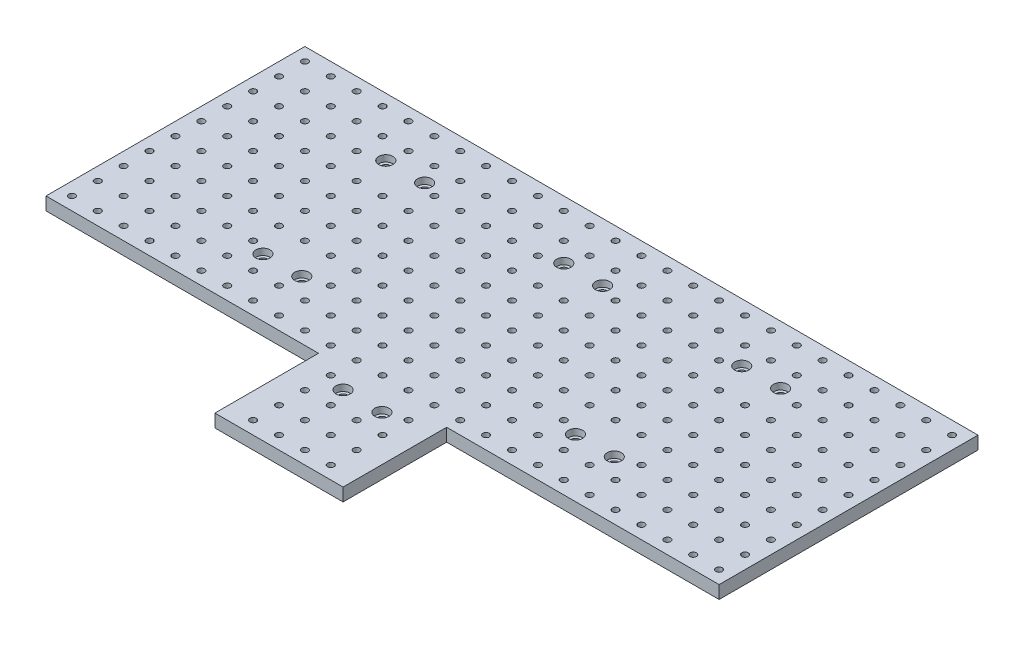
from build123d import *

# Parameters (mm, degrees)
SKETCH1_R           = 3.175
BOSS_EXTRUDE1_DEPTH = 12.7
SKETCH2_R           = 6.985
SKETCH2_R_2         = 4.191
CUT_EXTRUDE1_DEPTH  = 6.35
SKETCH2_2_R         = 4.191
CUT_EXTRUDE2_DEPTH  = 25.4
SKETCH2_3_R         = 4.191
CUT_EXTRUDE3_DEPTH  = 25.4


with BuildPart() as part:
    # Sketch1 → Boss-Extrude1 (new body)
    with BuildSketch(Plane(origin=(0, 0, 0), x_dir=(1, 0, 0), z_dir=(0, 1, 0))):
        Polygon((393.065, 0), (660.4, 0), (660.4, 254), (0, 254), (0, 0), (267.335, 0), (267.335, -101.6), (393.065, -101.6), align=None)
        with Locations(Location((12.7, 241.3, 0), (0, 0, 270))):
            Circle(SKETCH1_R, mode=Mode.SUBTRACT)
        with Locations(Location((38.1, 241.3, 0), (0, 0, 270))):
            Circle(SKETCH1_R, mode=Mode.SUBTRACT)
        with Locations(Location((63.5, 241.3, 0), (0, 0, 270))):
            Circle(SKETCH1_R, mode=Mode.SUBTRACT)
        with Locations(Location((88.9, 241.3, 0), (0, 0, 270))):
            Circle(SKETCH1_R, mode=Mode.SUBTRACT)
        with Locations(Location((114.3, 241.3, 0), (0, 0, 270))):
            Circle(SKETCH1_R, mode=Mode.SUBTRACT)
        with Locations(Location((139.7, 241.3, 0), (0, 0, 270))):
            Circle(SKETCH1_R, mode=Mode.SUBTRACT)
        with Locations(Location((165.1, 241.3, 0), (0, 0, 270))):
            Circle(SKETCH1_R, mode=Mode.SUBTRACT)
        with Locations(Location((190.5, 241.3, 0), (0, 0, 270))):
            Circle(SKETCH1_R, mode=Mode.SUBTRACT)
        with Locations(Location((215.9, 241.3, 0), (0, 0, 270))):
            Circle(SKETCH1_R, mode=Mode.SUBTRACT)
        with Locations(Location((241.3, 241.3, 0), (0, 0, 270))):
            Circle(SKETCH1_R, mode=Mode.SUBTRACT)
        with Locations(Location((266.7, 241.3, 0), (0, 0, 270))):
            Circle(SKETCH1_R, mode=Mode.SUBTRACT)
        with Locations(Location((292.1, 241.3, 0), (0, 0, 270))):
            Circle(SKETCH1_R, mode=Mode.SUBTRACT)
        with Locations(Location((317.5, 241.3, 0), (0, 0, 270))):
            Circle(SKETCH1_R, mode=Mode.SUBTRACT)
        with Locations(Location((342.9, 241.3, 0), (0, 0, 270))):
            Circle(SKETCH1_R, mode=Mode.SUBTRACT)
        with Locations(Location((368.3, 241.3, 0), (0, 0, 270))):
            Circle(SKETCH1_R, mode=Mode.SUBTRACT)
        with Locations(Location((393.7, 241.3, 0), (0, 0, 270))):
            Circle(SKETCH1_R, mode=Mode.SUBTRACT)
        with Locations(Location((419.1, 241.3, 0), (0, 0, 270))):
            Circle(SKETCH1_R, mode=Mode.SUBTRACT)
        with Locations(Location((444.5, 241.3, 0), (0, 0, 270))):
            Circle(SKETCH1_R, mode=Mode.SUBTRACT)
        with Locations(Location((469.9, 241.3, 0), (0, 0, 270))):
            Circle(SKETCH1_R, mode=Mode.SUBTRACT)
        with Locations(Location((495.3, 241.3, 0), (0, 0, 270))):
            Circle(SKETCH1_R, mode=Mode.SUBTRACT)
        with Locations(Location((520.7, 241.3, 0), (0, 0, 270))):
            Circle(SKETCH1_R, mode=Mode.SUBTRACT)
        with Locations(Location((546.1, 241.3, 0), (0, 0, 270))):
            Circle(SKETCH1_R, mode=Mode.SUBTRACT)
        with Locations(Location((571.5, 241.3, 0), (0, 0, 270))):
            Circle(SKETCH1_R, mode=Mode.SUBTRACT)
        with Locations(Location((596.9, 241.3, 0), (0, 0, 270))):
            Circle(SKETCH1_R, mode=Mode.SUBTRACT)
        with Locations(Location((622.3, 241.3, 0), (0, 0, 270))):
            Circle(SKETCH1_R, mode=Mode.SUBTRACT)
        with Locations(Location((647.7, 241.3, 0), (0, 0, 270))):
            Circle(SKETCH1_R, mode=Mode.SUBTRACT)
        with Locations(Location((38.1, 215.9, 0), (0, 0, 270))):
            Circle(SKETCH1_R, mode=Mode.SUBTRACT)
        with Locations(Location((63.5, 215.9, 0), (0, 0, 270))):
            Circle(SKETCH1_R, mode=Mode.SUBTRACT)
        with Locations(Location((88.9, 215.9, 0), (0, 0, 270))):
            Circle(SKETCH1_R, mode=Mode.SUBTRACT)
        with Locations(Location((114.3, 215.9, 0), (0, 0, 270))):
            Circle(SKETCH1_R, mode=Mode.SUBTRACT)
        with Locations(Location((139.7, 215.9, 0), (0, 0, 270))):
            Circle(SKETCH1_R, mode=Mode.SUBTRACT)
        with Locations(Location((165.1, 215.9, 0), (0, 0, 270))):
            Circle(SKETCH1_R, mode=Mode.SUBTRACT)
        with Locations(Location((190.5, 215.9, 0), (0, 0, 270))):
            Circle(SKETCH1_R, mode=Mode.SUBTRACT)
        with Locations(Location((215.9, 215.9, 0), (0, 0, 270))):
            Circle(SKETCH1_R, mode=Mode.SUBTRACT)
        with Locations(Location((241.3, 215.9, 0), (0, 0, 270))):
            Circle(SKETCH1_R, mode=Mode.SUBTRACT)
        with Locations(Location((266.7, 215.9, 0), (0, 0, 270))):
            Circle(SKETCH1_R, mode=Mode.SUBTRACT)
        with Locations(Location((292.1, 215.9, 0), (0, 0, 270))):
            Circle(SKETCH1_R, mode=Mode.SUBTRACT)
        with Locations(Location((317.5, 215.9, 0), (0, 0, 270))):
            Circle(SKETCH1_R, mode=Mode.SUBTRACT)
        with Locations(Location((342.9, 215.9, 0), (0, 0, 270))):
            Circle(SKETCH1_R, mode=Mode.SUBTRACT)
        with Locations(Location((368.3, 215.9, 0), (0, 0, 270))):
            Circle(SKETCH1_R, mode=Mode.SUBTRACT)
        with Locations(Location((393.7, 215.9, 0), (0, 0, 270))):
            Circle(SKETCH1_R, mode=Mode.SUBTRACT)
        with Locations(Location((419.1, 215.9, 0), (0, 0, 270))):
            Circle(SKETCH1_R, mode=Mode.SUBTRACT)
        with Locations(Location((444.5, 215.9, 0), (0, 0, 270))):
            Circle(SKETCH1_R, mode=Mode.SUBTRACT)
        with Locations(Location((469.9, 215.9, 0), (0, 0, 270))):
            Circle(SKETCH1_R, mode=Mode.SUBTRACT)
        with Locations(Location((495.3, 215.9, 0), (0, 0, 270))):
            Circle(SKETCH1_R, mode=Mode.SUBTRACT)
        with Locations(Location((520.7, 215.9, 0), (0, 0, 270))):
            Circle(SKETCH1_R, mode=Mode.SUBTRACT)
        with Locations(Location((546.1, 215.9, 0), (0, 0, 270))):
            Circle(SKETCH1_R, mode=Mode.SUBTRACT)
        with Locations(Location((571.5, 215.9, 0), (0, 0, 270))):
            Circle(SKETCH1_R, mode=Mode.SUBTRACT)
        with Locations(Location((596.9, 215.9, 0), (0, 0, 270))):
            Circle(SKETCH1_R, mode=Mode.SUBTRACT)
        with Locations(Location((622.3, 215.9, 0), (0, 0, 270))):
            Circle(SKETCH1_R, mode=Mode.SUBTRACT)
        with Locations(Location((647.7, 215.9, 0), (0, 0, 270))):
            Circle(SKETCH1_R, mode=Mode.SUBTRACT)
        with Locations(Location((38.1, 190.5, 0), (0, 0, 270))):
            Circle(SKETCH1_R, mode=Mode.SUBTRACT)
        with Locations(Location((63.5, 190.5, 0), (0, 0, 270))):
            Circle(SKETCH1_R, mode=Mode.SUBTRACT)
        with Locations(Location((88.9, 190.5, 0), (0, 0, 270))):
            Circle(SKETCH1_R, mode=Mode.SUBTRACT)
        with Locations(Location((114.3, 190.5, 0), (0, 0, 270))):
            Circle(SKETCH1_R, mode=Mode.SUBTRACT)
        with Locations(Location((190.5, 190.5, 0), (0, 0, 270))):
            Circle(SKETCH1_R, mode=Mode.SUBTRACT)
        with Locations(Location((215.9, 190.5, 0), (0, 0, 270))):
            Circle(SKETCH1_R, mode=Mode.SUBTRACT)
        with Locations(Location((241.3, 190.5, 0), (0, 0, 270))):
            Circle(SKETCH1_R, mode=Mode.SUBTRACT)
        with Locations(Location((266.7, 190.5, 0), (0, 0, 270))):
            Circle(SKETCH1_R, mode=Mode.SUBTRACT)
        with Locations(Location((292.1, 190.5, 0), (0, 0, 270))):
            Circle(SKETCH1_R, mode=Mode.SUBTRACT)
        with Locations(Location((368.3, 190.5, 0), (0, 0, 270))):
            Circle(SKETCH1_R, mode=Mode.SUBTRACT)
        with Locations(Location((393.7, 190.5, 0), (0, 0, 270))):
            Circle(SKETCH1_R, mode=Mode.SUBTRACT)
        with Locations(Location((419.1, 190.5, 0), (0, 0, 270))):
            Circle(SKETCH1_R, mode=Mode.SUBTRACT)
        with Locations(Location((444.5, 190.5, 0), (0, 0, 270))):
            Circle(SKETCH1_R, mode=Mode.SUBTRACT)
        with Locations(Location((469.9, 190.5, 0), (0, 0, 270))):
            Circle(SKETCH1_R, mode=Mode.SUBTRACT)
        with Locations(Location((546.1, 190.5, 0), (0, 0, 270))):
            Circle(SKETCH1_R, mode=Mode.SUBTRACT)
        with Locations(Location((571.5, 190.5, 0), (0, 0, 270))):
            Circle(SKETCH1_R, mode=Mode.SUBTRACT)
        with Locations(Location((596.9, 190.5, 0), (0, 0, 270))):
            Circle(SKETCH1_R, mode=Mode.SUBTRACT)
        with Locations(Location((622.3, 190.5, 0), (0, 0, 270))):
            Circle(SKETCH1_R, mode=Mode.SUBTRACT)
        with Locations(Location((647.7, 190.5, 0), (0, 0, 270))):
            Circle(SKETCH1_R, mode=Mode.SUBTRACT)
        with Locations(Location((38.1, 165.1, 0), (0, 0, 270))):
            Circle(SKETCH1_R, mode=Mode.SUBTRACT)
        with Locations(Location((63.5, 165.1, 0), (0, 0, 270))):
            Circle(SKETCH1_R, mode=Mode.SUBTRACT)
        with Locations(Location((88.9, 165.1, 0), (0, 0, 270))):
            Circle(SKETCH1_R, mode=Mode.SUBTRACT)
        with Locations(Location((114.3, 165.1, 0), (0, 0, 270))):
            Circle(SKETCH1_R, mode=Mode.SUBTRACT)
        with Locations(Location((139.7, 165.1, 0), (0, 0, 270))):
            Circle(SKETCH1_R, mode=Mode.SUBTRACT)
        with Locations(Location((165.1, 165.1, 0), (0, 0, 270))):
            Circle(SKETCH1_R, mode=Mode.SUBTRACT)
        with Locations(Location((190.5, 165.1, 0), (0, 0, 270))):
            Circle(SKETCH1_R, mode=Mode.SUBTRACT)
        with Locations(Location((215.9, 165.1, 0), (0, 0, 270))):
            Circle(SKETCH1_R, mode=Mode.SUBTRACT)
        with Locations(Location((241.3, 165.1, 0), (0, 0, 270))):
            Circle(SKETCH1_R, mode=Mode.SUBTRACT)
        with Locations(Location((266.7, 165.1, 0), (0, 0, 270))):
            Circle(SKETCH1_R, mode=Mode.SUBTRACT)
        with Locations(Location((292.1, 165.1, 0), (0, 0, 270))):
            Circle(SKETCH1_R, mode=Mode.SUBTRACT)
        with Locations(Location((317.5, 165.1, 0), (0, 0, 270))):
            Circle(SKETCH1_R, mode=Mode.SUBTRACT)
        with Locations(Location((342.9, 165.1, 0), (0, 0, 270))):
            Circle(SKETCH1_R, mode=Mode.SUBTRACT)
        with Locations(Location((368.3, 165.1, 0), (0, 0, 270))):
            Circle(SKETCH1_R, mode=Mode.SUBTRACT)
        with Locations(Location((393.7, 165.1, 0), (0, 0, 270))):
            Circle(SKETCH1_R, mode=Mode.SUBTRACT)
        with Locations(Location((419.1, 165.1, 0), (0, 0, 270))):
            Circle(SKETCH1_R, mode=Mode.SUBTRACT)
        with Locations(Location((444.5, 165.1, 0), (0, 0, 270))):
            Circle(SKETCH1_R, mode=Mode.SUBTRACT)
        with Locations(Location((469.9, 165.1, 0), (0, 0, 270))):
            Circle(SKETCH1_R, mode=Mode.SUBTRACT)
        with Locations(Location((495.3, 165.1, 0), (0, 0, 270))):
            Circle(SKETCH1_R, mode=Mode.SUBTRACT)
        with Locations(Location((520.7, 165.1, 0), (0, 0, 270))):
            Circle(SKETCH1_R, mode=Mode.SUBTRACT)
        with Locations(Location((546.1, 165.1, 0), (0, 0, 270))):
            Circle(SKETCH1_R, mode=Mode.SUBTRACT)
        with Locations(Location((571.5, 165.1, 0), (0, 0, 270))):
            Circle(SKETCH1_R, mode=Mode.SUBTRACT)
        with Locations(Location((596.9, 165.1, 0), (0, 0, 270))):
            Circle(SKETCH1_R, mode=Mode.SUBTRACT)
        with Locations(Location((622.3, 165.1, 0), (0, 0, 270))):
            Circle(SKETCH1_R, mode=Mode.SUBTRACT)
        with Locations(Location((647.7, 165.1, 0), (0, 0, 270))):
            Circle(SKETCH1_R, mode=Mode.SUBTRACT)
        with Locations(Location((38.1, 139.7, 0), (0, 0, 270))):
            Circle(SKETCH1_R, mode=Mode.SUBTRACT)
        with Locations(Location((63.5, 139.7, 0), (0, 0, 270))):
            Circle(SKETCH1_R, mode=Mode.SUBTRACT)
        with Locations(Location((88.9, 139.7, 0), (0, 0, 270))):
            Circle(SKETCH1_R, mode=Mode.SUBTRACT)
        with Locations(Location((114.3, 139.7, 0), (0, 0, 270))):
            Circle(SKETCH1_R, mode=Mode.SUBTRACT)
        with Locations(Location((139.7, 139.7, 0), (0, 0, 270))):
            Circle(SKETCH1_R, mode=Mode.SUBTRACT)
        with Locations(Location((165.1, 139.7, 0), (0, 0, 270))):
            Circle(SKETCH1_R, mode=Mode.SUBTRACT)
        with Locations(Location((190.5, 139.7, 0), (0, 0, 270))):
            Circle(SKETCH1_R, mode=Mode.SUBTRACT)
        with Locations(Location((215.9, 139.7, 0), (0, 0, 270))):
            Circle(SKETCH1_R, mode=Mode.SUBTRACT)
        with Locations(Location((241.3, 139.7, 0), (0, 0, 270))):
            Circle(SKETCH1_R, mode=Mode.SUBTRACT)
        with Locations(Location((266.7, 139.7, 0), (0, 0, 270))):
            Circle(SKETCH1_R, mode=Mode.SUBTRACT)
        with Locations(Location((292.1, 139.7, 0), (0, 0, 270))):
            Circle(SKETCH1_R, mode=Mode.SUBTRACT)
        with Locations(Location((317.5, 139.7, 0), (0, 0, 270))):
            Circle(SKETCH1_R, mode=Mode.SUBTRACT)
        with Locations(Location((342.9, 139.7, 0), (0, 0, 270))):
            Circle(SKETCH1_R, mode=Mode.SUBTRACT)
        with Locations(Location((368.3, 139.7, 0), (0, 0, 270))):
            Circle(SKETCH1_R, mode=Mode.SUBTRACT)
        with Locations(Location((393.7, 139.7, 0), (0, 0, 270))):
            Circle(SKETCH1_R, mode=Mode.SUBTRACT)
        with Locations(Location((419.1, 139.7, 0), (0, 0, 270))):
            Circle(SKETCH1_R, mode=Mode.SUBTRACT)
        with Locations(Location((444.5, 139.7, 0), (0, 0, 270))):
            Circle(SKETCH1_R, mode=Mode.SUBTRACT)
        with Locations(Location((469.9, 139.7, 0), (0, 0, 270))):
            Circle(SKETCH1_R, mode=Mode.SUBTRACT)
        with Locations(Location((495.3, 139.7, 0), (0, 0, 270))):
            Circle(SKETCH1_R, mode=Mode.SUBTRACT)
        with Locations(Location((520.7, 139.7, 0), (0, 0, 270))):
            Circle(SKETCH1_R, mode=Mode.SUBTRACT)
        with Locations(Location((546.1, 139.7, 0), (0, 0, 270))):
            Circle(SKETCH1_R, mode=Mode.SUBTRACT)
        with Locations(Location((571.5, 139.7, 0), (0, 0, 270))):
            Circle(SKETCH1_R, mode=Mode.SUBTRACT)
        with Locations(Location((596.9, 139.7, 0), (0, 0, 270))):
            Circle(SKETCH1_R, mode=Mode.SUBTRACT)
        with Locations(Location((622.3, 139.7, 0), (0, 0, 270))):
            Circle(SKETCH1_R, mode=Mode.SUBTRACT)
        with Locations(Location((647.7, 139.7, 0), (0, 0, 270))):
            Circle(SKETCH1_R, mode=Mode.SUBTRACT)
        with Locations(Location((38.1, 114.3, 0), (0, 0, 270))):
            Circle(SKETCH1_R, mode=Mode.SUBTRACT)
        with Locations(Location((63.5, 114.3, 0), (0, 0, 270))):
            Circle(SKETCH1_R, mode=Mode.SUBTRACT)
        with Locations(Location((88.9, 114.3, 0), (0, 0, 270))):
            Circle(SKETCH1_R, mode=Mode.SUBTRACT)
        with Locations(Location((114.3, 114.3, 0), (0, 0, 270))):
            Circle(SKETCH1_R, mode=Mode.SUBTRACT)
        with Locations(Location((139.7, 114.3, 0), (0, 0, 270))):
            Circle(SKETCH1_R, mode=Mode.SUBTRACT)
        with Locations(Location((165.1, 114.3, 0), (0, 0, 270))):
            Circle(SKETCH1_R, mode=Mode.SUBTRACT)
        with Locations(Location((190.5, 114.3, 0), (0, 0, 270))):
            Circle(SKETCH1_R, mode=Mode.SUBTRACT)
        with Locations(Location((215.9, 114.3, 0), (0, 0, 270))):
            Circle(SKETCH1_R, mode=Mode.SUBTRACT)
        with Locations(Location((241.3, 114.3, 0), (0, 0, 270))):
            Circle(SKETCH1_R, mode=Mode.SUBTRACT)
        with Locations(Location((266.7, 114.3, 0), (0, 0, 270))):
            Circle(SKETCH1_R, mode=Mode.SUBTRACT)
        with Locations(Location((292.1, 114.3, 0), (0, 0, 270))):
            Circle(SKETCH1_R, mode=Mode.SUBTRACT)
        with Locations(Location((317.5, 114.3, 0), (0, 0, 270))):
            Circle(SKETCH1_R, mode=Mode.SUBTRACT)
        with Locations(Location((342.9, 114.3, 0), (0, 0, 270))):
            Circle(SKETCH1_R, mode=Mode.SUBTRACT)
        with Locations(Location((368.3, 114.3, 0), (0, 0, 270))):
            Circle(SKETCH1_R, mode=Mode.SUBTRACT)
        with Locations(Location((393.7, 114.3, 0), (0, 0, 270))):
            Circle(SKETCH1_R, mode=Mode.SUBTRACT)
        with Locations(Location((419.1, 114.3, 0), (0, 0, 270))):
            Circle(SKETCH1_R, mode=Mode.SUBTRACT)
        with Locations(Location((444.5, 114.3, 0), (0, 0, 270))):
            Circle(SKETCH1_R, mode=Mode.SUBTRACT)
        with Locations(Location((469.9, 114.3, 0), (0, 0, 270))):
            Circle(SKETCH1_R, mode=Mode.SUBTRACT)
        with Locations(Location((495.3, 114.3, 0), (0, 0, 270))):
            Circle(SKETCH1_R, mode=Mode.SUBTRACT)
        with Locations(Location((520.7, 114.3, 0), (0, 0, 270))):
            Circle(SKETCH1_R, mode=Mode.SUBTRACT)
        with Locations(Location((546.1, 114.3, 0), (0, 0, 270))):
            Circle(SKETCH1_R, mode=Mode.SUBTRACT)
        with Locations(Location((571.5, 114.3, 0), (0, 0, 270))):
            Circle(SKETCH1_R, mode=Mode.SUBTRACT)
        with Locations(Location((596.9, 114.3, 0), (0, 0, 270))):
            Circle(SKETCH1_R, mode=Mode.SUBTRACT)
        with Locations(Location((622.3, 114.3, 0), (0, 0, 270))):
            Circle(SKETCH1_R, mode=Mode.SUBTRACT)
        with Locations(Location((647.7, 114.3, 0), (0, 0, 270))):
            Circle(SKETCH1_R, mode=Mode.SUBTRACT)
        with Locations(Location((38.1, 88.9, 0), (0, 0, 270))):
            Circle(SKETCH1_R, mode=Mode.SUBTRACT)
        with Locations(Location((63.5, 88.9, 0), (0, 0, 270))):
            Circle(SKETCH1_R, mode=Mode.SUBTRACT)
        with Locations(Location((88.9, 88.9, 0), (0, 0, 270))):
            Circle(SKETCH1_R, mode=Mode.SUBTRACT)
        with Locations(Location((114.3, 88.9, 0), (0, 0, 270))):
            Circle(SKETCH1_R, mode=Mode.SUBTRACT)
        with Locations(Location((139.7, 88.9, 0), (0, 0, 270))):
            Circle(SKETCH1_R, mode=Mode.SUBTRACT)
        with Locations(Location((165.1, 88.9, 0), (0, 0, 270))):
            Circle(SKETCH1_R, mode=Mode.SUBTRACT)
        with Locations(Location((190.5, 88.9, 0), (0, 0, 270))):
            Circle(SKETCH1_R, mode=Mode.SUBTRACT)
        with Locations(Location((215.9, 88.9, 0), (0, 0, 270))):
            Circle(SKETCH1_R, mode=Mode.SUBTRACT)
        with Locations(Location((241.3, 88.9, 0), (0, 0, 270))):
            Circle(SKETCH1_R, mode=Mode.SUBTRACT)
        with Locations(Location((266.7, 88.9, 0), (0, 0, 270))):
            Circle(SKETCH1_R, mode=Mode.SUBTRACT)
        with Locations(Location((292.1, 88.9, 0), (0, 0, 270))):
            Circle(SKETCH1_R, mode=Mode.SUBTRACT)
        with Locations(Location((317.5, 88.9, 0), (0, 0, 270))):
            Circle(SKETCH1_R, mode=Mode.SUBTRACT)
        with Locations(Location((342.9, 88.9, 0), (0, 0, 270))):
            Circle(SKETCH1_R, mode=Mode.SUBTRACT)
        with Locations(Location((368.3, 88.9, 0), (0, 0, 270))):
            Circle(SKETCH1_R, mode=Mode.SUBTRACT)
        with Locations(Location((393.7, 88.9, 0), (0, 0, 270))):
            Circle(SKETCH1_R, mode=Mode.SUBTRACT)
        with Locations(Location((419.1, 88.9, 0), (0, 0, 270))):
            Circle(SKETCH1_R, mode=Mode.SUBTRACT)
        with Locations(Location((444.5, 88.9, 0), (0, 0, 270))):
            Circle(SKETCH1_R, mode=Mode.SUBTRACT)
        with Locations(Location((469.9, 88.9, 0), (0, 0, 270))):
            Circle(SKETCH1_R, mode=Mode.SUBTRACT)
        with Locations(Location((495.3, 88.9, 0), (0, 0, 270))):
            Circle(SKETCH1_R, mode=Mode.SUBTRACT)
        with Locations(Location((520.7, 88.9, 0), (0, 0, 270))):
            Circle(SKETCH1_R, mode=Mode.SUBTRACT)
        with Locations(Location((546.1, 88.9, 0), (0, 0, 270))):
            Circle(SKETCH1_R, mode=Mode.SUBTRACT)
        with Locations(Location((571.5, 88.9, 0), (0, 0, 270))):
            Circle(SKETCH1_R, mode=Mode.SUBTRACT)
        with Locations(Location((596.9, 88.9, 0), (0, 0, 270))):
            Circle(SKETCH1_R, mode=Mode.SUBTRACT)
        with Locations(Location((622.3, 88.9, 0), (0, 0, 270))):
            Circle(SKETCH1_R, mode=Mode.SUBTRACT)
        with Locations(Location((647.7, 88.9, 0), (0, 0, 270))):
            Circle(SKETCH1_R, mode=Mode.SUBTRACT)
        with Locations(Location((38.1, 63.5, 0), (0, 0, 270))):
            Circle(SKETCH1_R, mode=Mode.SUBTRACT)
        with Locations(Location((63.5, 63.5, 0), (0, 0, 270))):
            Circle(SKETCH1_R, mode=Mode.SUBTRACT)
        with Locations(Location((88.9, 63.5, 0), (0, 0, 270))):
            Circle(SKETCH1_R, mode=Mode.SUBTRACT)
        with Locations(Location((114.3, 63.5, 0), (0, 0, 270))):
            Circle(SKETCH1_R, mode=Mode.SUBTRACT)
        with Locations(Location((139.7, 63.5, 0), (0, 0, 270))):
            Circle(SKETCH1_R, mode=Mode.SUBTRACT)
        with Locations(Location((215.9, 63.5, 0), (0, 0, 270))):
            Circle(SKETCH1_R, mode=Mode.SUBTRACT)
        with Locations(Location((241.3, 63.5, 0), (0, 0, 270))):
            Circle(SKETCH1_R, mode=Mode.SUBTRACT)
        with Locations(Location((266.7, 63.5, 0), (0, 0, 270))):
            Circle(SKETCH1_R, mode=Mode.SUBTRACT)
        with Locations(Location((292.1, 63.5, 0), (0, 0, 270))):
            Circle(SKETCH1_R, mode=Mode.SUBTRACT)
        with Locations(Location((317.5, 63.5, 0), (0, 0, 270))):
            Circle(SKETCH1_R, mode=Mode.SUBTRACT)
        with Locations(Location((342.9, 63.5, 0), (0, 0, 270))):
            Circle(SKETCH1_R, mode=Mode.SUBTRACT)
        with Locations(Location((368.3, 63.5, 0), (0, 0, 270))):
            Circle(SKETCH1_R, mode=Mode.SUBTRACT)
        with Locations(Location((393.7, 63.5, 0), (0, 0, 270))):
            Circle(SKETCH1_R, mode=Mode.SUBTRACT)
        with Locations(Location((419.1, 63.5, 0), (0, 0, 270))):
            Circle(SKETCH1_R, mode=Mode.SUBTRACT)
        with Locations(Location((444.5, 63.5, 0), (0, 0, 270))):
            Circle(SKETCH1_R, mode=Mode.SUBTRACT)
        with Locations(Location((520.7, 63.5, 0), (0, 0, 270))):
            Circle(SKETCH1_R, mode=Mode.SUBTRACT)
        with Locations(Location((546.1, 63.5, 0), (0, 0, 270))):
            Circle(SKETCH1_R, mode=Mode.SUBTRACT)
        with Locations(Location((571.5, 63.5, 0), (0, 0, 270))):
            Circle(SKETCH1_R, mode=Mode.SUBTRACT)
        with Locations(Location((596.9, 63.5, 0), (0, 0, 270))):
            Circle(SKETCH1_R, mode=Mode.SUBTRACT)
        with Locations(Location((622.3, 63.5, 0), (0, 0, 270))):
            Circle(SKETCH1_R, mode=Mode.SUBTRACT)
        with Locations(Location((647.7, 63.5, 0), (0, 0, 270))):
            Circle(SKETCH1_R, mode=Mode.SUBTRACT)
        with Locations(Location((38.1, 38.1, 0), (0, 0, 270))):
            Circle(SKETCH1_R, mode=Mode.SUBTRACT)
        with Locations(Location((63.5, 38.1, 0), (0, 0, 270))):
            Circle(SKETCH1_R, mode=Mode.SUBTRACT)
        with Locations(Location((88.9, 38.1, 0), (0, 0, 270))):
            Circle(SKETCH1_R, mode=Mode.SUBTRACT)
        with Locations(Location((114.3, 38.1, 0), (0, 0, 270))):
            Circle(SKETCH1_R, mode=Mode.SUBTRACT)
        with Locations(Location((139.7, 38.1, 0), (0, 0, 270))):
            Circle(SKETCH1_R, mode=Mode.SUBTRACT)
        with Locations(Location((165.1, 38.1, 0), (0, 0, 270))):
            Circle(SKETCH1_R, mode=Mode.SUBTRACT)
        with Locations(Location((190.5, 38.1, 0), (0, 0, 270))):
            Circle(SKETCH1_R, mode=Mode.SUBTRACT)
        with Locations(Location((215.9, 38.1, 0), (0, 0, 270))):
            Circle(SKETCH1_R, mode=Mode.SUBTRACT)
        with Locations(Location((241.3, 38.1, 0), (0, 0, 270))):
            Circle(SKETCH1_R, mode=Mode.SUBTRACT)
        with Locations(Location((266.7, 38.1, 0), (0, 0, 270))):
            Circle(SKETCH1_R, mode=Mode.SUBTRACT)
        with Locations(Location((292.1, 38.1, 0), (0, 0, 270))):
            Circle(SKETCH1_R, mode=Mode.SUBTRACT)
        with Locations(Location((317.5, 38.1, 0), (0, 0, 270))):
            Circle(SKETCH1_R, mode=Mode.SUBTRACT)
        with Locations(Location((342.9, 38.1, 0), (0, 0, 270))):
            Circle(SKETCH1_R, mode=Mode.SUBTRACT)
        with Locations(Location((368.3, 38.1, 0), (0, 0, 270))):
            Circle(SKETCH1_R, mode=Mode.SUBTRACT)
        with Locations(Location((393.7, 38.1, 0), (0, 0, 270))):
            Circle(SKETCH1_R, mode=Mode.SUBTRACT)
        with Locations(Location((419.1, 38.1, 0), (0, 0, 270))):
            Circle(SKETCH1_R, mode=Mode.SUBTRACT)
        with Locations(Location((444.5, 38.1, 0), (0, 0, 270))):
            Circle(SKETCH1_R, mode=Mode.SUBTRACT)
        with Locations(Location((469.9, 38.1, 0), (0, 0, 270))):
            Circle(SKETCH1_R, mode=Mode.SUBTRACT)
        with Locations(Location((495.3, 38.1, 0), (0, 0, 270))):
            Circle(SKETCH1_R, mode=Mode.SUBTRACT)
        with Locations(Location((520.7, 38.1, 0), (0, 0, 270))):
            Circle(SKETCH1_R, mode=Mode.SUBTRACT)
        with Locations(Location((546.1, 38.1, 0), (0, 0, 270))):
            Circle(SKETCH1_R, mode=Mode.SUBTRACT)
        with Locations(Location((571.5, 38.1, 0), (0, 0, 270))):
            Circle(SKETCH1_R, mode=Mode.SUBTRACT)
        with Locations(Location((596.9, 38.1, 0), (0, 0, 270))):
            Circle(SKETCH1_R, mode=Mode.SUBTRACT)
        with Locations(Location((622.3, 38.1, 0), (0, 0, 270))):
            Circle(SKETCH1_R, mode=Mode.SUBTRACT)
        with Locations(Location((647.7, 38.1, 0), (0, 0, 270))):
            Circle(SKETCH1_R, mode=Mode.SUBTRACT)
        with Locations(Location((38.1, 12.7, 0), (0, 0, 270))):
            Circle(SKETCH1_R, mode=Mode.SUBTRACT)
        with Locations(Location((63.5, 12.7, 0), (0, 0, 270))):
            Circle(SKETCH1_R, mode=Mode.SUBTRACT)
        with Locations(Location((88.9, 12.7, 0), (0, 0, 270))):
            Circle(SKETCH1_R, mode=Mode.SUBTRACT)
        with Locations(Location((114.3, 12.7, 0), (0, 0, 270))):
            Circle(SKETCH1_R, mode=Mode.SUBTRACT)
        with Locations(Location((139.7, 12.7, 0), (0, 0, 270))):
            Circle(SKETCH1_R, mode=Mode.SUBTRACT)
        with Locations(Location((165.1, 12.7, 0), (0, 0, 270))):
            Circle(SKETCH1_R, mode=Mode.SUBTRACT)
        with Locations(Location((190.5, 12.7, 0), (0, 0, 270))):
            Circle(SKETCH1_R, mode=Mode.SUBTRACT)
        with Locations(Location((215.9, 12.7, 0), (0, 0, 270))):
            Circle(SKETCH1_R, mode=Mode.SUBTRACT)
        with Locations(Location((241.3, 12.7, 0), (0, 0, 270))):
            Circle(SKETCH1_R, mode=Mode.SUBTRACT)
        with Locations(Location((266.7, 12.7, 0), (0, 0, 270))):
            Circle(SKETCH1_R, mode=Mode.SUBTRACT)
        with Locations(Location((292.1, 12.7, 0), (0, 0, 270))):
            Circle(SKETCH1_R, mode=Mode.SUBTRACT)
        with Locations(Location((317.5, 12.7, 0), (0, 0, 270))):
            Circle(SKETCH1_R, mode=Mode.SUBTRACT)
        with Locations(Location((342.9, 12.7, 0), (0, 0, 270))):
            Circle(SKETCH1_R, mode=Mode.SUBTRACT)
        with Locations(Location((368.3, 12.7, 0), (0, 0, 270))):
            Circle(SKETCH1_R, mode=Mode.SUBTRACT)
        with Locations(Location((393.7, 12.7, 0), (0, 0, 270))):
            Circle(SKETCH1_R, mode=Mode.SUBTRACT)
        with Locations(Location((419.1, 12.7, 0), (0, 0, 270))):
            Circle(SKETCH1_R, mode=Mode.SUBTRACT)
        with Locations(Location((444.5, 12.7, 0), (0, 0, 270))):
            Circle(SKETCH1_R, mode=Mode.SUBTRACT)
        with Locations(Location((469.9, 12.7, 0), (0, 0, 270))):
            Circle(SKETCH1_R, mode=Mode.SUBTRACT)
        with Locations(Location((495.3, 12.7, 0), (0, 0, 270))):
            Circle(SKETCH1_R, mode=Mode.SUBTRACT)
        with Locations(Location((520.7, 12.7, 0), (0, 0, 270))):
            Circle(SKETCH1_R, mode=Mode.SUBTRACT)
        with Locations(Location((546.1, 12.7, 0), (0, 0, 270))):
            Circle(SKETCH1_R, mode=Mode.SUBTRACT)
        with Locations(Location((571.5, 12.7, 0), (0, 0, 270))):
            Circle(SKETCH1_R, mode=Mode.SUBTRACT)
        with Locations(Location((596.9, 12.7, 0), (0, 0, 270))):
            Circle(SKETCH1_R, mode=Mode.SUBTRACT)
        with Locations(Location((622.3, 12.7, 0), (0, 0, 270))):
            Circle(SKETCH1_R, mode=Mode.SUBTRACT)
        with Locations(Location((647.7, 12.7, 0), (0, 0, 270))):
            Circle(SKETCH1_R, mode=Mode.SUBTRACT)
        with Locations(Location((292.1, -12.7, 0), (0, 0, 270))):
            Circle(SKETCH1_R, mode=Mode.SUBTRACT)
        with Locations(Location((368.3, -12.7, 0), (0, 0, 270))):
            Circle(SKETCH1_R, mode=Mode.SUBTRACT)
        with Locations(Location((292.1, -38.1, 0), (0, 0, 270))):
            Circle(SKETCH1_R, mode=Mode.SUBTRACT)
        with Locations(Location((317.5, -38.1, 0), (0, 0, 270))):
            Circle(SKETCH1_R, mode=Mode.SUBTRACT)
        with Locations(Location((342.9, -38.1, 0), (0, 0, 270))):
            Circle(SKETCH1_R, mode=Mode.SUBTRACT)
        with Locations(Location((368.3, -38.1, 0), (0, 0, 270))):
            Circle(SKETCH1_R, mode=Mode.SUBTRACT)
        with Locations(Location((292.1, -63.5, 0), (0, 0, 270))):
            Circle(SKETCH1_R, mode=Mode.SUBTRACT)
        with Locations(Location((317.5, -63.5, 0), (0, 0, 270))):
            Circle(SKETCH1_R, mode=Mode.SUBTRACT)
        with Locations(Location((342.9, -63.5, 0), (0, 0, 270))):
            Circle(SKETCH1_R, mode=Mode.SUBTRACT)
        with Locations(Location((368.3, -63.5, 0), (0, 0, 270))):
            Circle(SKETCH1_R, mode=Mode.SUBTRACT)
        with Locations(Location((292.1, -88.9, 0), (0, 0, 270))):
            Circle(SKETCH1_R, mode=Mode.SUBTRACT)
        with Locations(Location((317.5, -88.9, 0), (0, 0, 270))):
            Circle(SKETCH1_R, mode=Mode.SUBTRACT)
        with Locations(Location((342.9, -88.9, 0), (0, 0, 270))):
            Circle(SKETCH1_R, mode=Mode.SUBTRACT)
        with Locations(Location((368.3, -88.9, 0), (0, 0, 270))):
            Circle(SKETCH1_R, mode=Mode.SUBTRACT)
        with Locations(Location((12.7, 215.9, 0), (0, 0, 270))):
            Circle(SKETCH1_R, mode=Mode.SUBTRACT)
        with Locations(Location((12.7, 190.5, 0), (0, 0, 270))):
            Circle(SKETCH1_R, mode=Mode.SUBTRACT)
        with Locations(Location((12.7, 165.1, 0), (0, 0, 270))):
            Circle(SKETCH1_R, mode=Mode.SUBTRACT)
        with Locations(Location((12.7, 139.7, 0), (0, 0, 270))):
            Circle(SKETCH1_R, mode=Mode.SUBTRACT)
        with Locations(Location((12.7, 114.3, 0), (0, 0, 270))):
            Circle(SKETCH1_R, mode=Mode.SUBTRACT)
        with Locations(Location((12.7, 88.9, 0), (0, 0, 270))):
            Circle(SKETCH1_R, mode=Mode.SUBTRACT)
        with Locations(Location((12.7, 63.5, 0), (0, 0, 270))):
            Circle(SKETCH1_R, mode=Mode.SUBTRACT)
        with Locations(Location((12.7, 38.1, 0), (0, 0, 270))):
            Circle(SKETCH1_R, mode=Mode.SUBTRACT)
        with Locations(Location((12.7, 12.7, 0), (0, 0, 270))):
            Circle(SKETCH1_R, mode=Mode.SUBTRACT)
    extrude(amount=BOSS_EXTRUDE1_DEPTH)

    # Sketch2 → Cut-Extrude1 (cut)
    # profile 1 of 12: a face of its own
    with BuildSketch(Plane(origin=(0, 12.7, 0), x_dir=(1, 0, 0), z_dir=(0, 1, 0))):
        with Locations(Location((136.525, 196.85, 0), (0, 0, 270))):
            Circle(SKETCH2_R)
        with Locations(Location((136.525, 196.85, 0), (0, 0, 270))):
            Circle(SKETCH2_R_2, mode=Mode.SUBTRACT)
    # profile 2 of 12: a face of its own
    with BuildSketch(Plane(origin=(0, 12.7, 0), x_dir=(1, 0, 0), z_dir=(0, 1, 0))):
        with Locations(Location((174.625, 196.85, 0), (0, 0, 270))):
            Circle(SKETCH2_R)
        with Locations(Location((174.625, 196.85, 0), (0, 0, 270))):
            Circle(SKETCH2_R_2, mode=Mode.SUBTRACT)
    # profile 3 of 12: a face of its own
    with BuildSketch(Plane(origin=(0, 12.7, 0), x_dir=(1, 0, 0), z_dir=(0, 1, 0))):
        with Locations(Location((311.15, 196.85, 0), (0, 0, 270))):
            Circle(SKETCH2_R)
        with Locations(Location((311.15, 196.85, 0), (0, 0, 270))):
            Circle(SKETCH2_R_2, mode=Mode.SUBTRACT)
    # profile 4 of 12: a face of its own
    with BuildSketch(Plane(origin=(0, 12.7, 0), x_dir=(1, 0, 0), z_dir=(0, 1, 0))):
        with Locations(Location((349.25, 196.85, 0), (0, 0, 270))):
            Circle(SKETCH2_R)
        with Locations(Location((349.25, 196.85, 0), (0, 0, 270))):
            Circle(SKETCH2_R_2, mode=Mode.SUBTRACT)
    # profile 5 of 12: a face of its own
    with BuildSketch(Plane(origin=(0, 12.7, 0), x_dir=(1, 0, 0), z_dir=(0, 1, 0))):
        with Locations(Location((485.775, 196.85, 0), (0, 0, 270))):
            Circle(SKETCH2_R)
        with Locations(Location((485.775, 196.85, 0), (0, 0, 270))):
            Circle(SKETCH2_R_2, mode=Mode.SUBTRACT)
    # profile 6 of 12: a face of its own
    with BuildSketch(Plane(origin=(0, 12.7, 0), x_dir=(1, 0, 0), z_dir=(0, 1, 0))):
        with Locations(Location((523.875, 196.85, 0), (0, 0, 270))):
            Circle(SKETCH2_R)
        with Locations(Location((523.875, 196.85, 0), (0, 0, 270))):
            Circle(SKETCH2_R_2, mode=Mode.SUBTRACT)
    # profile 7 of 12: a face of its own
    with BuildSketch(Plane(origin=(0, 12.7, 0), x_dir=(1, 0, 0), z_dir=(0, 1, 0))):
        with Locations(Location((310.515, -19.05, 0), (0, 0, 270))):
            Circle(SKETCH2_R)
        with Locations(Location((310.515, -19.05, 0), (0, 0, 270))):
            Circle(SKETCH2_R_2, mode=Mode.SUBTRACT)
    # profile 8 of 12: a face of its own
    with BuildSketch(Plane(origin=(0, 12.7, 0), x_dir=(1, 0, 0), z_dir=(0, 1, 0))):
        with Locations(Location((348.615, -19.05, 0), (0, 0, 270))):
            Circle(SKETCH2_R)
        with Locations(Location((348.615, -19.05, 0), (0, 0, 270))):
            Circle(SKETCH2_R_2, mode=Mode.SUBTRACT)
    # profile 9 of 12: a face of its own
    with BuildSketch(Plane(origin=(0, 12.7, 0), x_dir=(1, 0, 0), z_dir=(0, 1, 0))):
        with Locations(Location((155.677696571, 57.15, 0), (0, 0, 270))):
            Circle(SKETCH2_R)
        with Locations(Location((155.677696571, 57.15, 0), (0, 0, 270))):
            Circle(SKETCH2_R_2, mode=Mode.SUBTRACT)
    # profile 10 of 12: a face of its own
    with BuildSketch(Plane(origin=(0, 12.7, 0), x_dir=(1, 0, 0), z_dir=(0, 1, 0))):
        with Locations(Location((193.777696571, 57.15, 0), (0, 0, 270))):
            Circle(SKETCH2_R)
        with Locations(Location((193.777696571, 57.15, 0), (0, 0, 270))):
            Circle(SKETCH2_R_2, mode=Mode.SUBTRACT)
    # profile 11 of 12: a face of its own
    with BuildSketch(Plane(origin=(0, 12.7, 0), x_dir=(1, 0, 0), z_dir=(0, 1, 0))):
        with Locations(Location((462.291058343, 57.15, 0), (0, 0, 270))):
            Circle(SKETCH2_R)
        with Locations(Location((462.291058343, 57.15, 0), (0, 0, 270))):
            Circle(SKETCH2_R_2, mode=Mode.SUBTRACT)
    # profile 12 of 12: a face of its own
    with BuildSketch(Plane(origin=(0, 12.7, 0), x_dir=(1, 0, 0), z_dir=(0, 1, 0))):
        with Locations(Location((500.391058343, 57.15, 0), (0, 0, 270))):
            Circle(SKETCH2_R)
        with Locations(Location((500.391058343, 57.15, 0), (0, 0, 270))):
            Circle(SKETCH2_R_2, mode=Mode.SUBTRACT)
    extrude(amount=-CUT_EXTRUDE1_DEPTH, mode=Mode.SUBTRACT)

    # Sketch2<2> → Cut-Extrude2 (cut)
    with BuildSketch(Plane(origin=(0, 12.7, 0), x_dir=(1, 0, 0), z_dir=(0, 1, 0))):
        with Locations(Location((136.525, 196.85, 0), (0, 0, 270))):
            Circle(SKETCH2_2_R)
        with Locations(Location((174.625, 196.85, 0), (0, 0, 270))):
            Circle(SKETCH2_2_R)
        with Locations(Location((311.15, 196.85, 0), (0, 0, 270))):
            Circle(SKETCH2_2_R)
        with Locations(Location((349.25, 196.85, 0), (0, 0, 270))):
            Circle(SKETCH2_2_R)
        with Locations(Location((485.775, 196.85, 0), (0, 0, 270))):
            Circle(SKETCH2_2_R)
        with Locations(Location((523.875, 196.85, 0), (0, 0, 270))):
            Circle(SKETCH2_2_R)
    extrude(amount=-CUT_EXTRUDE2_DEPTH, mode=Mode.SUBTRACT)

    # Sketch2<3> → Cut-Extrude3 (cut)
    with BuildSketch(Plane(origin=(0, 12.7, 0), x_dir=(1, 0, 0), z_dir=(0, 1, 0))):
        with Locations(Location((310.515, -19.05, 0), (0, 0, 270))):
            Circle(SKETCH2_3_R)
        with Locations(Location((348.615, -19.05, 0), (0, 0, 270))):
            Circle(SKETCH2_3_R)
        with Locations(Location((155.677696571, 57.15, 0), (0, 0, 270))):
            Circle(SKETCH2_3_R)
        with Locations(Location((193.777696571, 57.15, 0), (0, 0, 270))):
            Circle(SKETCH2_3_R)
        with Locations(Location((462.291058343, 57.15, 0), (0, 0, 270))):
            Circle(SKETCH2_3_R)
        with Locations(Location((500.391058343, 57.15, 0), (0, 0, 270))):
            Circle(SKETCH2_3_R)
    extrude(amount=-CUT_EXTRUDE3_DEPTH, mode=Mode.SUBTRACT)


solid = part.part
